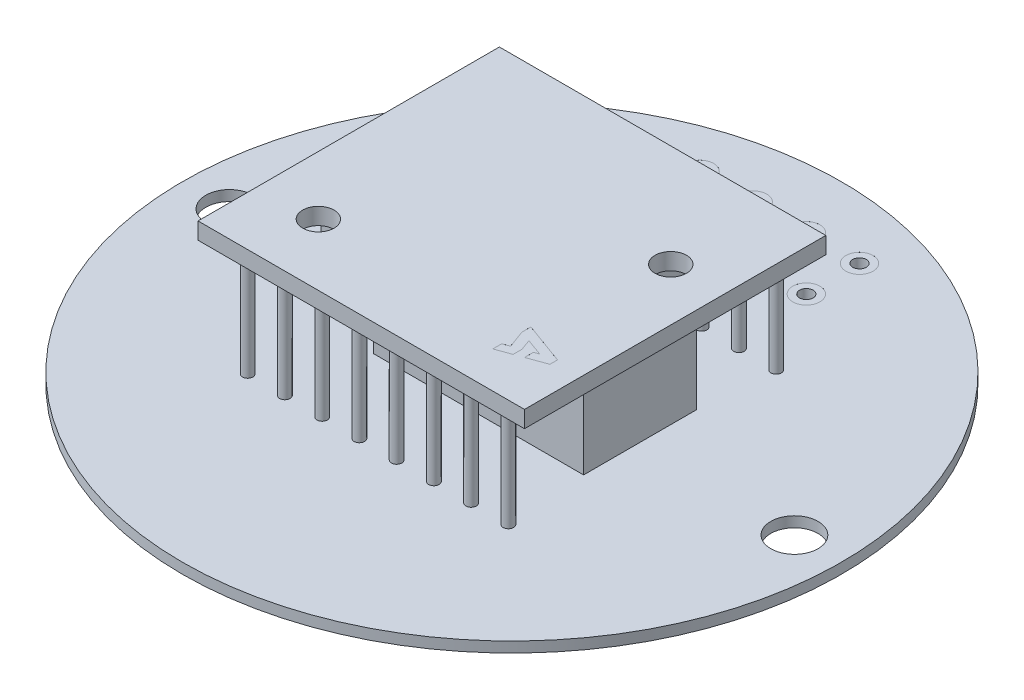
from build123d import *

# Parameters (mm, degrees)
SKETCH1_R                      = 15.75
BOSS_EXTRUDE1_DEPTH            = 0.5
BOSS_EXTRUDE2_START            = 5.15
SKETCH2_W                      = 15.6
SKETCH2_H                      = 14.4
SKETCH2_R                      = 0.75
BOSS_EXTRUDE2_DEPTH            = 0.8
CUT_EXTRUDE1_DEPTH             = 0.001
BOSS_EXTRUDE3_DEPTH            = 3.7
BOSS_EXTRUDE4_REACH            = 24.979
SKETCH5_R                      = 0.25
SKETCH9_W                      = 1.130000026
SKETCH9_H                      = 0.5
F_2_CLEARANCE_HOLE1_AT_2_COUNT = 2
F_2_CLEARANCE_HOLE1_AT_2_PITCH = 27
SKETCH10_R                     = 0.325
CUT_EXTRUDE2_DEPTH             = 24.054880178
SKETCH11_R                     = 0.65
CUT_EXTRUDE3_DEPTH             = 0.001


with BuildPart() as part:
    # Sketch1 → Boss-Extrude1 (new body)
    with BuildSketch(Plane(origin=(0, 0, 0), x_dir=(1, 0, 0), z_dir=(0, 1, 0))):
        with Locations(Location((0, 0, 0), (0, 0, 270))):
            Circle(SKETCH1_R)
    extrude(amount=BOSS_EXTRUDE1_DEPTH)


with BuildPart() as body_2:
    # Sketch2 → Boss-Extrude2 (new body)
    with BuildSketch(Plane(origin=(0, 0.5, 0), x_dir=(1, 0, 0), z_dir=(0, 1, 0)).offset(BOSS_EXTRUDE2_START)):
        Rectangle(SKETCH2_W, SKETCH2_H)
        with Locations(Location((-5, -4.25, 0), (0, 0, 270))):
            Circle(SKETCH2_R, mode=Mode.SUBTRACT)
        with Locations(Location((5.29, 2.3, 0), (0, 0, 270))):
            Circle(SKETCH2_R, mode=Mode.SUBTRACT)
    extrude(amount=BOSS_EXTRUDE2_DEPTH)

    # Sketch3 → Cut-Extrude1 (cut)
    with BuildSketch(Plane(origin=(0, 6.45, 0), x_dir=(1, 0, 0), z_dir=(0, 1, 0))):
        Polygon((6.54, -4.362217601), (4.54, -3.634277132), (4.54, -4.059948241), (4.851272778, -4.915163169), (4.54, -5.028457195), (4.54, -5.454128304), (5.251272778, -5.195246184), (5.251272778, -4.769575075), (5.062162916, -4.25), (5.87047824, -4.544202718), (5.651272778, -4.623986981), (5.651272778, -5.04965809), (6.54, -4.726187835), align=None)
    extrude(amount=-CUT_EXTRUDE1_DEPTH, mode=Mode.SUBTRACT)

    # Sketch4 → Boss-Extrude3 (add)
    with BuildSketch(Plane.XZ.offset(-5.65)):
        with BuildLine():
            Line((7.425, -1.4), (7.425, 4))
            Line((7.425, 4), (-2.625, 4))
            Line((-2.625, 4), (-2.625, 2.7))
            ThreePointArc((-2.625, 2.7), (-2.917893219, 1.992893219), (-3.625, 1.7))
            Line((-3.625, 1.7), (-7.425, 1.7))
            Line((-7.425, 1.7), (-7.425, -4))
            Line((-7.425, -4), (4.425, -4))
            Line((4.425, -4), (4.425, -2.4))
            ThreePointArc((4.425, -2.4), (4.717893219, -1.692893219), (5.425, -1.4))
            Line((5.425, -1.4), (7.425, -1.4))
        make_face()
    extrude(amount=BOSS_EXTRUDE3_DEPTH)


    # Sketch5 → Boss-Extrude4 (add, up to next)
    with BuildSketch(Plane.XZ.offset(-5.65), mode=Mode.PRIVATE) as boss_extrude4_sk1:
        with Locations(Location((6.23, 6.4, 0), (0, 0, 90))):
            Circle(SKETCH5_R)
    boss_extrude4_tool1 = extrude(boss_extrude4_sk1.sketch, amount=BOSS_EXTRUDE4_REACH, mode=Mode.PRIVATE) - part.part
    # Sketch5 → Boss-Extrude4 (add, up to next)
    with BuildSketch(Plane.XZ.offset(-5.65), mode=Mode.PRIVATE) as boss_extrude4_sk2:
        with Locations(Location((6.23, -6.4, 0), (0, 0, 90))):
            Circle(SKETCH5_R)
    boss_extrude4_tool2 = extrude(boss_extrude4_sk2.sketch, amount=BOSS_EXTRUDE4_REACH, mode=Mode.PRIVATE) - part.part
    # Sketch5 → Boss-Extrude4 (add, up to next)
    with BuildSketch(Plane.XZ.offset(-5.65), mode=Mode.PRIVATE) as boss_extrude4_sk3:
        with Locations(Location((4.45, 6.4, 0), (0, 0, 90))):
            Circle(SKETCH5_R)
    boss_extrude4_tool3 = extrude(boss_extrude4_sk3.sketch, amount=BOSS_EXTRUDE4_REACH, mode=Mode.PRIVATE) - part.part
    # Sketch5 → Boss-Extrude4 (add, up to next)
    with BuildSketch(Plane.XZ.offset(-5.65), mode=Mode.PRIVATE) as boss_extrude4_sk4:
        with Locations(Location((4.45, -6.4, 0), (0, 0, 90))):
            Circle(SKETCH5_R)
    boss_extrude4_tool4 = extrude(boss_extrude4_sk4.sketch, amount=BOSS_EXTRUDE4_REACH, mode=Mode.PRIVATE) - part.part
    # Sketch5 → Boss-Extrude4 (add, up to next)
    with BuildSketch(Plane.XZ.offset(-5.65), mode=Mode.PRIVATE) as boss_extrude4_sk5:
        with Locations(Location((2.67, 6.4, 0), (0, 0, 90))):
            Circle(SKETCH5_R)
    boss_extrude4_tool5 = extrude(boss_extrude4_sk5.sketch, amount=BOSS_EXTRUDE4_REACH, mode=Mode.PRIVATE) - part.part
    # Sketch5 → Boss-Extrude4 (add, up to next)
    with BuildSketch(Plane.XZ.offset(-5.65), mode=Mode.PRIVATE) as boss_extrude4_sk6:
        with Locations(Location((2.67, -6.4, 0), (0, 0, 90))):
            Circle(SKETCH5_R)
    boss_extrude4_tool6 = extrude(boss_extrude4_sk6.sketch, amount=BOSS_EXTRUDE4_REACH, mode=Mode.PRIVATE) - part.part
    # Sketch5 → Boss-Extrude4 (add, up to next)
    with BuildSketch(Plane.XZ.offset(-5.65), mode=Mode.PRIVATE) as boss_extrude4_sk7:
        with Locations(Location((0.89, 6.4, 0), (0, 0, 90))):
            Circle(SKETCH5_R)
    boss_extrude4_tool7 = extrude(boss_extrude4_sk7.sketch, amount=BOSS_EXTRUDE4_REACH, mode=Mode.PRIVATE) - part.part
    # Sketch5 → Boss-Extrude4 (add, up to next)
    with BuildSketch(Plane.XZ.offset(-5.65), mode=Mode.PRIVATE) as boss_extrude4_sk8:
        with Locations(Location((0.89, -6.4, 0), (0, 0, 90))):
            Circle(SKETCH5_R)
    boss_extrude4_tool8 = extrude(boss_extrude4_sk8.sketch, amount=BOSS_EXTRUDE4_REACH, mode=Mode.PRIVATE) - part.part
    # Sketch5 → Boss-Extrude4 (add, up to next)
    with BuildSketch(Plane.XZ.offset(-5.65), mode=Mode.PRIVATE) as boss_extrude4_sk9:
        with Locations(Location((-0.89, 6.4, 0), (0, 0, 90))):
            Circle(SKETCH5_R)
    boss_extrude4_tool9 = extrude(boss_extrude4_sk9.sketch, amount=BOSS_EXTRUDE4_REACH, mode=Mode.PRIVATE) - part.part
    # Sketch5 → Boss-Extrude4 (add, up to next)
    with BuildSketch(Plane.XZ.offset(-5.65), mode=Mode.PRIVATE) as boss_extrude4_sk10:
        with Locations(Location((-0.89, -6.4, 0), (0, 0, 90))):
            Circle(SKETCH5_R)
    boss_extrude4_tool10 = extrude(boss_extrude4_sk10.sketch, amount=BOSS_EXTRUDE4_REACH, mode=Mode.PRIVATE) - part.part
    # Sketch5 → Boss-Extrude4 (add, up to next)
    with BuildSketch(Plane.XZ.offset(-5.65), mode=Mode.PRIVATE) as boss_extrude4_sk11:
        with Locations(Location((-2.67, 6.4, 0), (0, 0, 90))):
            Circle(SKETCH5_R)
    boss_extrude4_tool11 = extrude(boss_extrude4_sk11.sketch, amount=BOSS_EXTRUDE4_REACH, mode=Mode.PRIVATE) - part.part
    # Sketch5 → Boss-Extrude4 (add, up to next)
    with BuildSketch(Plane.XZ.offset(-5.65), mode=Mode.PRIVATE) as boss_extrude4_sk12:
        with Locations(Location((-2.67, -6.4, 0), (0, 0, 90))):
            Circle(SKETCH5_R)
    boss_extrude4_tool12 = extrude(boss_extrude4_sk12.sketch, amount=BOSS_EXTRUDE4_REACH, mode=Mode.PRIVATE) - part.part
    # Sketch5 → Boss-Extrude4 (add, up to next)
    with BuildSketch(Plane.XZ.offset(-5.65), mode=Mode.PRIVATE) as boss_extrude4_sk13:
        with Locations(Location((-4.45, 6.4, 0), (0, 0, 90))):
            Circle(SKETCH5_R)
    boss_extrude4_tool13 = extrude(boss_extrude4_sk13.sketch, amount=BOSS_EXTRUDE4_REACH, mode=Mode.PRIVATE) - part.part
    # Sketch5 → Boss-Extrude4 (add, up to next)
    with BuildSketch(Plane.XZ.offset(-5.65), mode=Mode.PRIVATE) as boss_extrude4_sk14:
        with Locations(Location((-4.45, -6.4, 0), (0, 0, 90))):
            Circle(SKETCH5_R)
    boss_extrude4_tool14 = extrude(boss_extrude4_sk14.sketch, amount=BOSS_EXTRUDE4_REACH, mode=Mode.PRIVATE) - part.part
    # Sketch5 → Boss-Extrude4 (add, up to next)
    with BuildSketch(Plane.XZ.offset(-5.65), mode=Mode.PRIVATE) as boss_extrude4_sk15:
        with Locations(Location((-6.23, 6.4, 0), (0, 0, 90))):
            Circle(SKETCH5_R)
    boss_extrude4_tool15 = extrude(boss_extrude4_sk15.sketch, amount=BOSS_EXTRUDE4_REACH, mode=Mode.PRIVATE) - part.part
    # Sketch5 → Boss-Extrude4 (add, up to next)
    with BuildSketch(Plane.XZ.offset(-5.65), mode=Mode.PRIVATE) as boss_extrude4_sk16:
        with Locations(Location((-6.23, -6.4, 0), (0, 0, 90))):
            Circle(SKETCH5_R)
    boss_extrude4_tool16 = extrude(boss_extrude4_sk16.sketch, amount=BOSS_EXTRUDE4_REACH, mode=Mode.PRIVATE) - part.part
    add(boss_extrude4_tool1.solids().sort_by_distance((6.23, 5.65, 6.4))[0])
    add(boss_extrude4_tool2.solids().sort_by_distance((6.23, 5.65, -6.4))[0])
    add(boss_extrude4_tool3.solids().sort_by_distance((4.45, 5.65, 6.4))[0])
    add(boss_extrude4_tool4.solids().sort_by_distance((4.45, 5.65, -6.4))[0])
    add(boss_extrude4_tool5.solids().sort_by_distance((2.67, 5.65, 6.4))[0])
    add(boss_extrude4_tool6.solids().sort_by_distance((2.67, 5.65, -6.4))[0])
    add(boss_extrude4_tool7.solids().sort_by_distance((0.89, 5.65, 6.4))[0])
    add(boss_extrude4_tool8.solids().sort_by_distance((0.89, 5.65, -6.4))[0])
    add(boss_extrude4_tool9.solids().sort_by_distance((-0.89, 5.65, 6.4))[0])
    add(boss_extrude4_tool10.solids().sort_by_distance((-0.89, 5.65, -6.4))[0])
    add(boss_extrude4_tool11.solids().sort_by_distance((-2.67, 5.65, 6.4))[0])
    add(boss_extrude4_tool12.solids().sort_by_distance((-2.67, 5.65, -6.4))[0])
    add(boss_extrude4_tool13.solids().sort_by_distance((-4.45, 5.65, 6.4))[0])
    add(boss_extrude4_tool14.solids().sort_by_distance((-4.45, 5.65, -6.4))[0])
    add(boss_extrude4_tool15.solids().sort_by_distance((-6.23, 5.65, 6.4))[0])
    add(boss_extrude4_tool16.solids().sort_by_distance((-6.23, 5.65, -6.4))[0])


with BuildPart() as part_1:
    add(part.part)

    # Sketch9 → #2 Clearance Hole1 (revolve, cut)
    with BuildSketch(Plane(origin=(13.5, 0.5, 0), x_dir=(0, 0, 1), z_dir=(1, 0, 0))):
        with Locations((0.565000013, 0.25)):
            Rectangle(SKETCH9_W, SKETCH9_H)
    f_2_clearance_hole1 = revolve(axis=Axis((13.5, 6.85, 0), (0, -1, 0)), mode=Mode.SUBTRACT)

    # #2 Clearance Hole1 at 2: #2 Clearance Hole1 ×2
    with Locations(*[(-i * F_2_CLEARANCE_HOLE1_AT_2_PITCH, 0, 0) for i in range(1, F_2_CLEARANCE_HOLE1_AT_2_COUNT)]):
        add(f_2_clearance_hole1, mode=Mode.SUBTRACT)

    # Sketch10 → Cut-Extrude2 (cut, through all)
    with BuildSketch(Plane(origin=(0, 0.5, 0), x_dir=(1, 0, 0), z_dir=(0, 1, 0))):
        with Locations(Location((3.81, 12.8, 0), (0, 0, 270))):
            Circle(SKETCH10_R)
        with Locations(Location((1.27, 12.8, 0), (0, 0, 270))):
            Circle(SKETCH10_R)
        with Locations(Location((-1.27, 12.8, 0), (0, 0, 270))):
            Circle(SKETCH10_R)
        with Locations(Location((-3.81, 12.8, 0), (0, 0, 270))):
            Circle(SKETCH10_R)
        with Locations(Location((1.27, 10.26, 0), (0, 0, 270))):
            Circle(SKETCH10_R)
        with Locations(Location((-1.27, 10.26, 0), (0, 0, 270))):
            Circle(SKETCH10_R)
        with Locations(Location((-3.81, 10.26, 0), (0, 0, 270))):
            Circle(SKETCH10_R)
        with Locations(Location((3.81, 10.26, 0), (0, 0, 270))):
            Circle(SKETCH10_R)
    extrude(amount=-CUT_EXTRUDE2_DEPTH, mode=Mode.SUBTRACT)

    # Sketch11 → Cut-Extrude3 (cut)
    with BuildSketch(Plane(origin=(0, 0.5, 0), x_dir=(1, 0, 0), z_dir=(0, 1, 0))):
        with Locations(Location((3.81, 12.8, 0), (0, 0, 270))):
            Circle(SKETCH11_R)
        with Locations(Location((1.27, 12.8, 0), (0, 0, 270))):
            Circle(SKETCH11_R)
        with Locations(Location((-1.27, 12.8, 0), (0, 0, 270))):
            Circle(SKETCH11_R)
        with Locations(Location((-3.81, 12.8, 0), (0, 0, 270))):
            Circle(SKETCH11_R)
        with Locations(Location((1.27, 10.26, 0), (0, 0, 270))):
            Circle(SKETCH11_R)
        with Locations(Location((-1.27, 10.26, 0), (0, 0, 270))):
            Circle(SKETCH11_R)
        with Locations(Location((-3.81, 10.26, 0), (0, 0, 270))):
            Circle(SKETCH11_R)
        with Locations(Location((3.81, 10.26, 0), (0, 0, 270))):
            Circle(SKETCH11_R)
    extrude(amount=-CUT_EXTRUDE3_DEPTH, mode=Mode.SUBTRACT)


solid = Compound([body_2.part, part_1.part])
